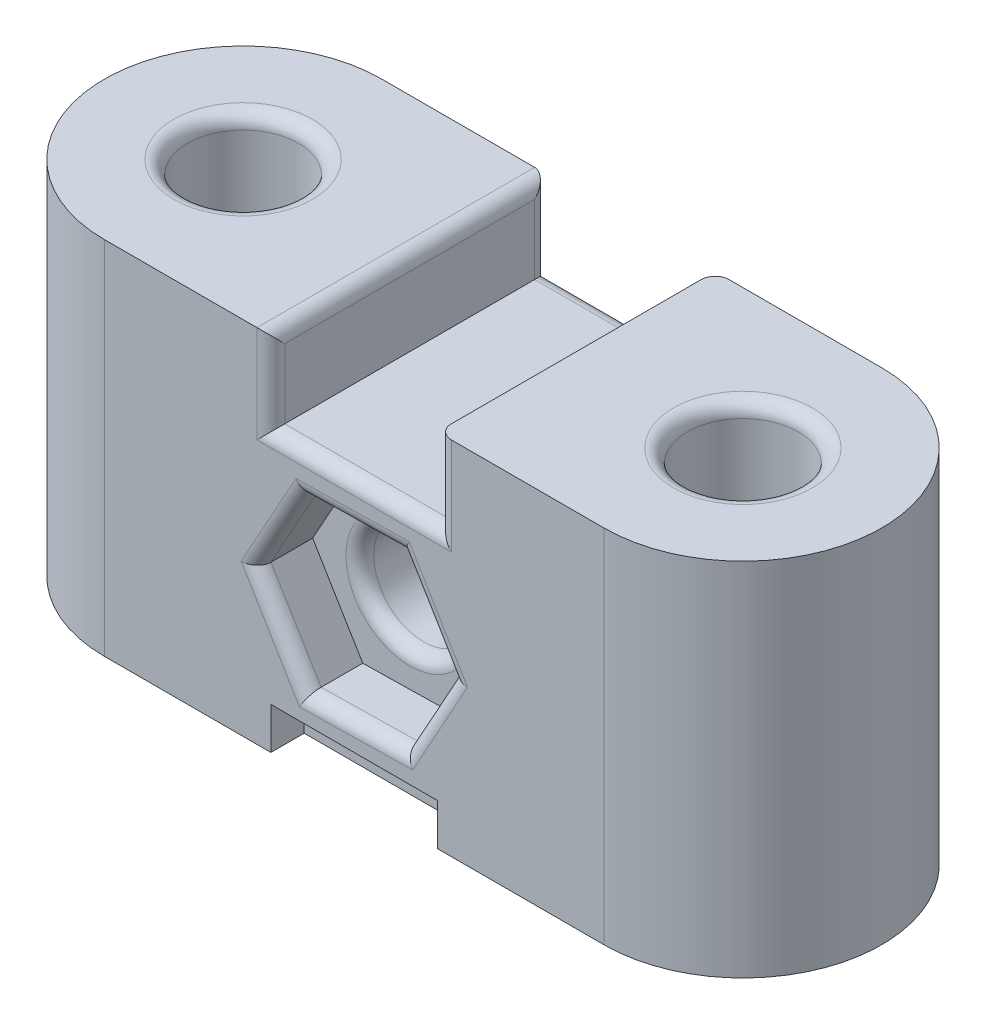
from build123d import *

# Parameters (mm, degrees)
BOSS_EXTRUDE2_DEPTH = 13
SCREW_HOLES_R       = 2
CUT_EXTRUDE1_DEPTH  = 13
FILLET1_R           = 0.5
BELT_OPENING_W      = 6
BELT_OPENING_H      = 10
CUT_EXTRUDE2_DEPTH  = 3
CUT_EXTRUDE3_DEPTH  = 2
STRETCHER_HOLE_R    = 1.8
CUT_EXTRUDE4_DEPTH  = 8
FILLET2_R           = 0.5
FILLET3_R           = 0.5
FILLET8_R           = 0.5
FILLET9_R           = 0.5
SKETCH1_W           = 6
SKETCH1_H           = 2.4
SKETCH1_H_2         = 2.6
CUT_EXTRUDE5_DEPTH  = 1.5


with BuildPart() as part:
    # Belt Clamp → Boss-Extrude2 (new body)
    with BuildSketch(Plane(origin=(0, 0, 0), x_dir=(1, 0, 0), z_dir=(0, 1, 0))):
        with BuildLine():
            Line((-18, 10), (0, 10))
            ThreePointArc((0, 10), (5, 5), (0, 0))
            Line((0, 0), (-18, 0))
            ThreePointArc((-18, 0), (-23, 5), (-18, 10))
        make_face()
    extrude(amount=BOSS_EXTRUDE2_DEPTH)

    # Screw Holes → Cut-Extrude1 (cut)
    with BuildSketch(Plane.XZ):
        with Locations(Location((0, -5, 0), (0, 0, 270))):
            Circle(SCREW_HOLES_R)
        with Locations(Location((-18, -5, 0), (0, 0, 270))):
            Circle(SCREW_HOLES_R)
    extrude(amount=-CUT_EXTRUDE1_DEPTH, mode=Mode.SUBTRACT)

    # Fillet1
    fillet1_edges = [part.edges().sort_by_distance(p)[0] for p in [
        (0, 0, -3),
        (0, 13, -3),
        (-18, 0, -3),
        (-18, 13, -3),
    ]]
    fillet(fillet1_edges, radius=FILLET1_R)

    # Belt Opening → Cut-Extrude2 (cut)
    with BuildSketch(Plane(origin=(0, 13, 0), x_dir=(1, 0, 0), z_dir=(0, 1, 0))):
        with Locations((-9, 5)):
            Rectangle(BELT_OPENING_W, BELT_OPENING_H)
    extrude(amount=-CUT_EXTRUDE2_DEPTH, mode=Mode.SUBTRACT)

    # Hex Nut → Cut-Extrude3 (cut)
    with BuildSketch(Plane.XY):
        Polygon((-12.494989746, 5.437207375), (-10.690891397, 2.438002623), (-7.191454715, 2.500795248), (-5.496116383, 5.562792625), (-7.300214732, 8.561997377), (-10.799651413, 8.499204752), align=None)
    extrude(amount=-CUT_EXTRUDE3_DEPTH, mode=Mode.SUBTRACT)

    # Stretcher Hole → Cut-Extrude4 (cut)
    with BuildSketch(Plane.XY.offset(-2)):
        with Locations((-8.995553064, 5.5)):
            Circle(STRETCHER_HOLE_R)
    extrude(amount=-CUT_EXTRUDE4_DEPTH, mode=Mode.SUBTRACT)

    # Fillet2
    fillet2_edges = [part.edges().sort_by_distance(p)[0] for p in [
        (-10.795553064, 5.5, -2),
        (-10.795553064, 5.5, -10),
    ]]
    fillet(fillet2_edges, radius=FILLET2_R)

    # Fillet3
    fillet3_edges = [part.edges().sort_by_distance(p)[0] for p in [
        (-11.64732058, 6.968206064, 0),
        (-11.592940571, 3.937604999, 0),
        (-8.941173056, 2.469398935, 0),
        (-6.343785549, 4.031793936, 0),
        (-6.398165558, 7.062395001, 0),
        (-9.049933073, 8.530601065, 0),
    ]]
    fillet(fillet3_edges, radius=FILLET3_R)

    # Fillet8
    fillet8_edges = [part.edges().sort_by_distance(p)[0] for p in [
        (-12, 11.5, 0),
        (-9, 10, -10),
        (-12, 11.5, -10),
        (-6, 11.5, -10),
        (-6, 11.5, 0),
        (-12, 13, -5),
    ]]
    fillet(fillet8_edges, radius=FILLET8_R)

    # Fillet9
    fillet9_edges = [part.edges().sort_by_distance(p)[0] for p in [
        (-9, 10, 0),
    ]]
    fillet(fillet9_edges, radius=FILLET9_R)

    # Sketch1 → Cut-Extrude5 (cut)
    with BuildSketch(Plane.XZ):
        with Locations((-9, 0)):
            Rectangle(SKETCH1_W, SKETCH1_H)
        with Locations((-9, -5)):
            Rectangle(SKETCH1_W, SKETCH1_H_2)
        with Locations((-9, -10)):
            Rectangle(SKETCH1_W, SKETCH1_H)
    extrude(amount=-CUT_EXTRUDE5_DEPTH, mode=Mode.SUBTRACT)


solid = part.part
